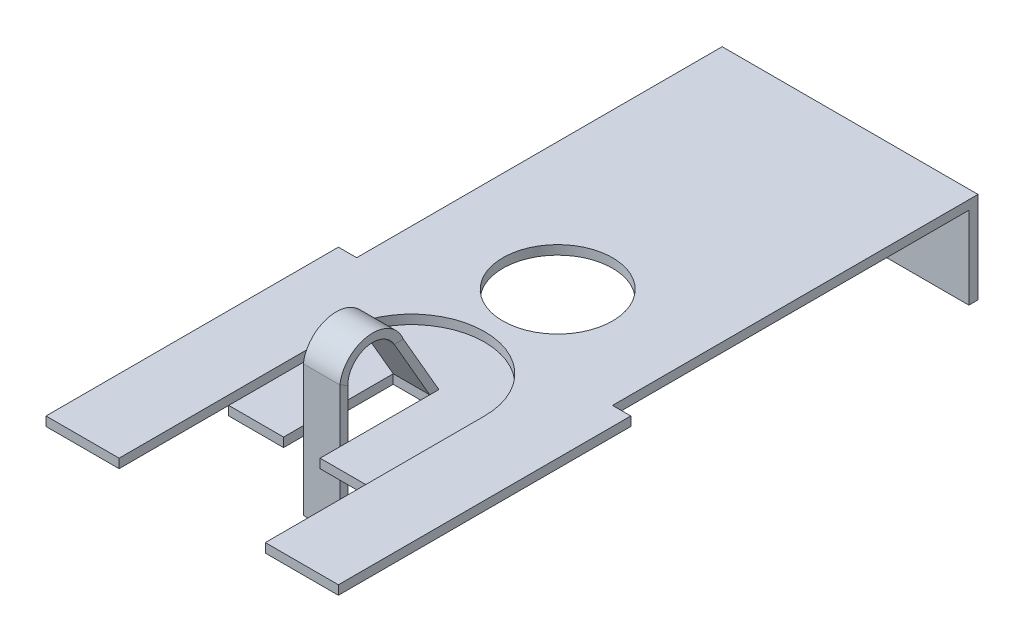
from build123d import *

# Parameters (mm, degrees)
SKETCH1_R           = 2.38125
BOSS_EXTRUDE1_DEPTH = 0.396875
BOSS_EXTRUDE3_DEPTH = 0.396875
SKETCH6_W           = 1.5875
SKETCH6_H           = 0.396875
SKETCH7_W           = 11.1125
SKETCH7_H           = 3.571875
BOSS_EXTRUDE4_DEPTH = 0.396875


with BuildPart() as part:
    # Sketch1 → Boss-Extrude1 (new body)
    with BuildSketch(Plane(origin=(0, 0, 0), x_dir=(1, 0, 0), z_dir=(0, 1, 0))):
        with BuildLine():
            Line((-6.35, -6.35), (-3.175, -6.35))
            Line((-3.175, -6.35), (-3.175, 0))
            Line((-3.175, 0), (-3.175, 3.175))
            ThreePointArc((-3.175, 3.175), (0, 6.35), (3.175, 3.175))
            Line((3.175, 3.175), (3.175, 0))
            Line((3.175, 0), (3.175, -6.35))
            Line((3.175, -6.35), (6.35, -6.35))
            Line((6.35, -6.35), (6.35, 6.35))
            Line((6.35, 6.35), (5.55625, 6.35))
            Line((5.55625, 6.35), (5.55625, 22.225))
            Line((5.55625, 22.225), (-5.55625, 22.225))
            Line((-5.55625, 22.225), (-5.55625, 6.35))
            Line((-5.55625, 6.35), (-6.35, 6.35))
            Line((-6.35, 6.35), (-6.35, -6.35))
        make_face()
        with Locations(Location((0, 9.525, 0), (0, 0, 270))):
            Circle(SKETCH1_R, mode=Mode.SUBTRACT)
    extrude(amount=BOSS_EXTRUDE1_DEPTH)

    # Sketch7 → Boss-Extrude4 (add)
    with BuildSketch(Plane(origin=(0, 0, -22.225), x_dir=(-1, 0, 0), z_dir=(0, 0, -1))):
        with Locations((0, -1.7859375)):
            Rectangle(SKETCH7_W, SKETCH7_H)
    extrude(amount=-BOSS_EXTRUDE4_DEPTH)


with BuildPart() as body_2:
    # Sketch3 → Boss-Extrude3 (new body)
    with BuildSketch(Plane.XZ):
        with BuildLine():
            Line((-3.175, -3.175), (-3.175, 1.5875))
            Line((-3.175, 1.5875), (-0.79375, 1.5875))
            Line((-0.79375, 1.5875), (-0.79375, -3.175))
            Line((-0.79375, -3.175), (0.79375, -3.175))
            Line((0.79375, -3.175), (0.79375, 1.5875))
            Line((0.79375, 1.5875), (3.175, 1.5875))
            Line((3.175, 1.5875), (3.175, -3.175))
            ThreePointArc((3.175, -3.175), (0, -6.35), (-3.175, -3.175))
        make_face()
    extrude(amount=BOSS_EXTRUDE3_DEPTH)

    # Sweep1: sweep along a path in Sketch5
    with BuildLine(Plane(origin=(0, 0, 0), x_dir=(0, 0, -1), z_dir=(1, 0, 0))) as sweep1_path:
        Line((3.175, 0), (1.633092115, 2.670662798))
        ThreePointArc((1.633092115, 2.670662798), (0.415514402, 3.175), (-0.386770227, 2.129442315))
        Line((-0.386770227, 2.129442315), (-0.386770227, -3.571875))
    # Sketch6 → Sweep1 (sweep)
    with BuildSketch(Plane(origin=(0, 0, 0), x_dir=(1, 0, 0), z_dir=(0, 1, 0))):
        with Locations((0, 3.3734375)):
            Rectangle(SKETCH6_W, SKETCH6_H)
    sweep(path=sweep1_path.line)


solid = Compound([part.part, body_2.part])
